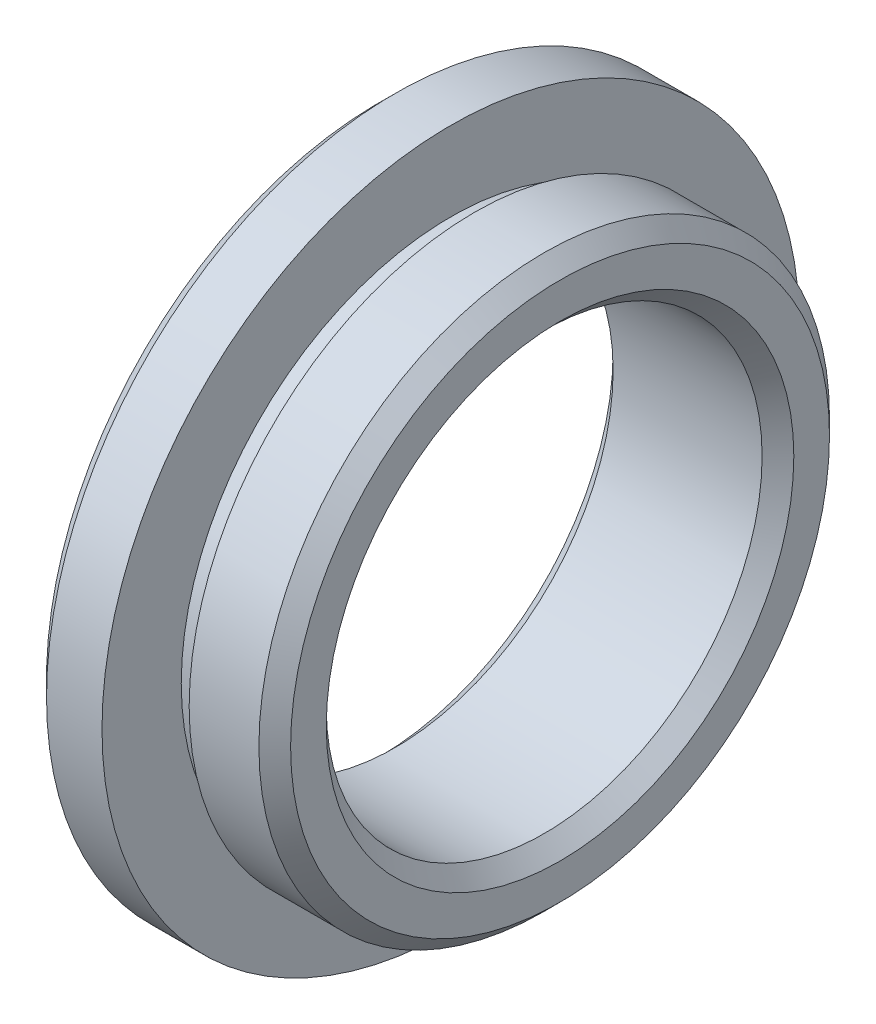
from build123d import *

# Parameters (mm, degrees)
CHANFREIN1_SIZE = 1


with BuildPart() as part:
    # Esquisse1 → Révolution1 (revolve)
    with BuildSketch(Plane.XY, mode=Mode.PRIVATE) as r_volution1_sk:
        Polygon((0, 13.75), (0, 22), (4.5, 22), (4.5, 17), (6, 17), (6, 18), (11.4, 18), (11.4, 13.75), align=None)
    revolve(r_volution1_sk.sketch.rotate(Axis((0, 0, 0), (1, 0, 0)), 90), axis=Axis((0, 0, 0), (1, 0, 0)))

    # Chanfrein1
    chanfrein1_edges = [part.edges().sort_by_distance(p)[0] for p in [
        (11.4, 0, -13.75),
        (11.4, 0, -18),
        (0, 0, -22),
        (0, 0, -13.75),
    ]]
    chamfer(chanfrein1_edges, length=CHANFREIN1_SIZE)

    # Esquisse3 → Diamètre du perçage Ø3.1 (3.1)1 (revolve, cut)
    with BuildSketch(Plane.ZX.offset(18.5)):
        Polygon((0, 0), (0, 4.031333959), (1.55, 3.1), (1.55, 0), align=None)
    diam_tre_du_per_age_3_1_3_1_1 = revolve(axis=Axis((-6.35, 18.5, 0), (1, 0, 0)), mode=Mode.SUBTRACT)

    # Symétrie1: Diamètre du perçage Ø3.1 (3.1)1 across plane
    add(diam_tre_du_per_age_3_1_3_1_1.mirror(Plane.ZX), mode=Mode.SUBTRACT)


solid = part.part
